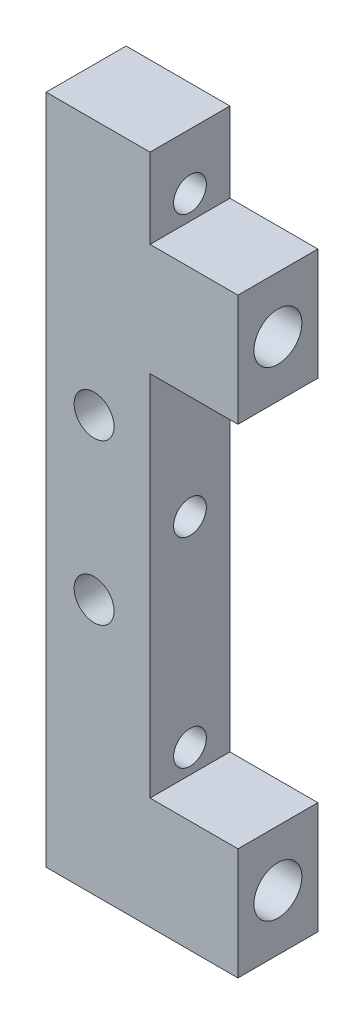
from build123d import *

# Parameters (mm, degrees)
ESQUISSE1_W              = 5
ESQUISSE1_H              = 42
ESQUISSE1_R              = 1.5
EXTRUSION1_DEPTH         = 6
TROU_TARAUD_M3X0_51_D    = 2.5
ESQUISSE4_OUTSIDE_W      = 22.794
ESQUISSE4_OUTSIDE_H      = 52.794
ENL_V_MAT_EXTRU_1_DEPTH  = 23.405356502
TROU_TARAUD_M2_5X0_451_D = 2.05


with BuildPart() as part:
    # Esquisse1 → Extrusion1 (new, symmetric)
    with BuildSketch(Plane(origin=(0, 0, 0), x_dir=(0, 0, -1), z_dir=(1, 0, 0))):
        Rectangle(ESQUISSE1_W, ESQUISSE1_H)
        with Locations((0, -17.5)):
            Circle(ESQUISSE1_R, mode=Mode.SUBTRACT)
        with Locations((0, 12.5)):
            Circle(ESQUISSE1_R, mode=Mode.SUBTRACT)
    extrude(amount=EXTRUSION1_DEPTH, both=True)

    # Trou taraudé M3x0.51 (through all)
    with Locations(Plane(origin=(0, 0, -2.5), x_dir=(-1, 0, 0), z_dir=(0, 0, -1))):
        with Locations((3, 5), (3, -5)):
            Hole(TROU_TARAUD_M3X0_51_D / 2)

    # Esquisse4 outside → Enlèv. mat.-Extru.1 (cut, through all)
    with BuildSketch(Plane(origin=(0, 0, -2.5), x_dir=(-1, 0, 0), z_dir=(0, 0, -1))):
        Rectangle(ESQUISSE4_OUTSIDE_W, ESQUISSE4_OUTSIDE_H)
        Polygon((6, 21), (-0.5, 21), (-0.5, 16), (-6, 16), (-6, 9), (-0.5, 9), (-0.5, -14), (-6, -14), (-6, -21), (6, -21), align=None, mode=Mode.SUBTRACT)
    extrude(amount=-ENL_V_MAT_EXTRU_1_DEPTH, mode=Mode.SUBTRACT)

    # Trou taraudé M2.5x0.451 (through all)
    with Locations(Plane.ZY.offset(6)):
        with Locations((0, 17.5), (0, 0), (0, -12.5)):
            Hole(TROU_TARAUD_M2_5X0_451_D / 2)


solid = part.part
